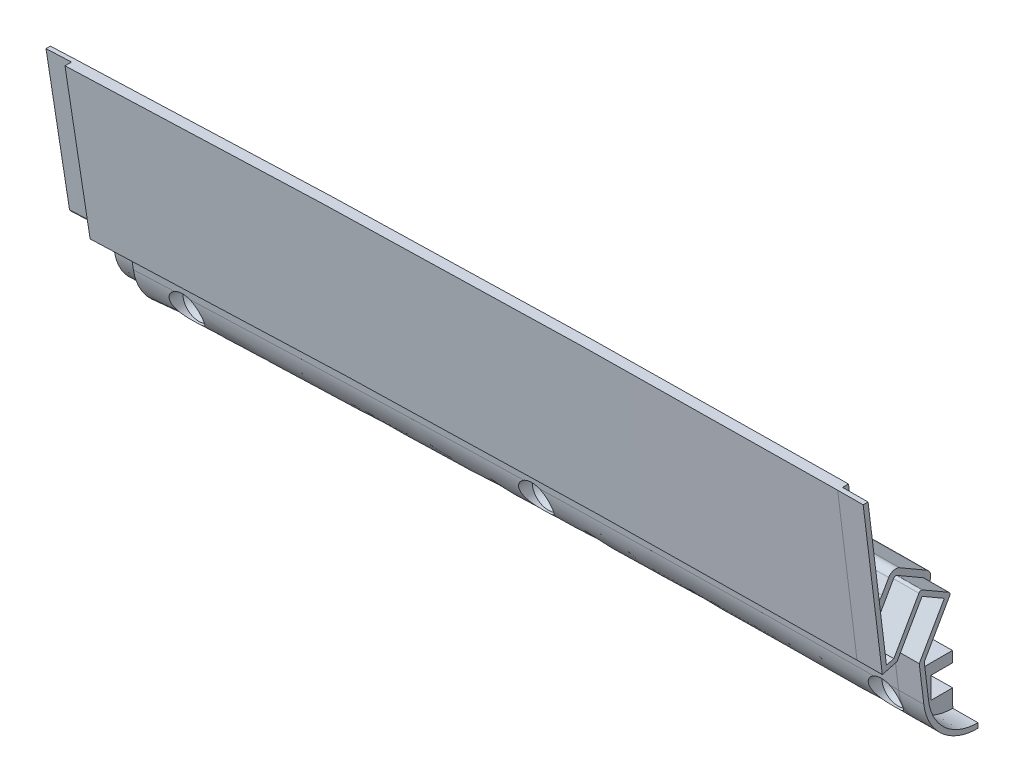
from build123d import *


with BuildPart() as part:
    # Sweep3: sweep along a path in Sketch3
    with BuildLine(Plane.XY.offset(101.6)) as sweep3_path:
        ThreePointArc((622.103936151, -83.199836272), (0, -43.636564626), (-622.103936151, -83.199836272))
    # Sketch4 → Sweep3 (sweep)
    with BuildSketch(Plane(origin=(-117.330566703, 4.430423936, 1117.6), x_dir=(0, 0, -1), z_dir=(0.9994536405585157, 0.03305178322465143, 0))):
        with BuildLine():
            Line((991.529482971, -5.453775083), (988.971801376, -5.453775083))
            Line((988.971801376, -5.453775083), (993.32506615, -42.283775083))
            Line((993.32506615, -42.283775083), (996.794703229, -41.354088728))
            Line((996.794703229, -41.354088728), (1002.763703229, -31.015013775))
            Line((1002.763703229, -31.015013775), (1007.999, -34.037749136))
            Line((1007.999, -34.037749136), (1002.03, -44.376824659))
            Line((1002.03, -44.376824659), (1003.077032208, -53.235049058))
            ThreePointArc((1003.077032208, -53.235049058), (1007.29752688, -61.276835992), (1015.8095, -64.443731312))
            Line((1015.8095, -64.443731312), (1015.8095, -59.12218153))
            Line((1015.8095, -59.12218153), (1010.7295, -59.12218153))
            Line((1010.7295, -59.12218153), (1010.7295, -54.041969025))
            Line((1010.7295, -54.041969025), (1015.8095, -54.041969025))
            Line((1015.8095, -54.041969025), (1015.8095, -51.501969025))
            Line((1015.8095, -51.501969025), (1007.687322123, -51.501969025))
            ThreePointArc((1007.687322123, -51.501969025), (1005.99997215, -50.860507955), (1005.164881483, -49.260118685))
            Line((1005.164881483, -49.260118685), (1004.750455768, -45.75394576))
            ThreePointArc((1004.750455768, -45.75394576), (1004.7850335, -44.943801809), (1005.073167189, -44.18583887))
            Line((1005.073167189, -44.18583887), (1010.516206197, -34.757795418))
            ThreePointArc((1010.516206197, -34.757795418), (1010.706497969, -33.312277166), (1009.818941274, -32.155567572))
            Line((1009.818941274, -32.155567572), (1003.483804566, -28.49781089))
            ThreePointArc((1003.483804566, -28.49781089), (1002.038222268, -28.307482122), (1000.881475684, -29.195102853))
            Line((1000.881475684, -29.195102853), (999.272416391, -31.982200293))
            ThreePointArc((999.272416391, -31.982200293), (996.560692883, -33.200105913), (994.550246564, -31.010392672))
            Line((994.550246564, -31.010392672), (991.529482971, -5.453775083))
        make_face()
    sweep(path=sweep3_path.line)

    # SurfaceCut1
    split(bisect_by=Plane(origin=(-211.442164364, -9.040193423, 0), x_dir=(0.04271589869142412, -0.9990872594518379, 0), z_dir=(-0.9990872594518379, -0.04271589869142412, 0)), keep=Keep.BOTTOM)

    # SurfaceCut2
    split(bisect_by=Plane(origin=(-29.192599192, -0.172013281, 0), x_dir=(-0.005892256941615429, 0.9999826405033909, 0), z_dir=(0.999982640503391, 0.005892256941615429, 0)), keep=Keep.BOTTOM)

    # Sketch8 → Cut-Revolve1 (revolve, cut)
    with BuildSketch(Plane(origin=(-117.056038996, -3.871025798, 0), x_dir=(0, 0, -1), z_dir=(0.9994536405585157, 0.03305178322465143, 0)), mode=Mode.PRIVATE) as cut_revolve1_sk:
        Polygon((-119.5705, -48.27608749), (-106.8705, -48.27608749), (-106.8705, -46.37108749), (-108.7755, -46.37108749), (-110.6805, -44.46608749), (-119.5705, -44.46608749), align=None)
    cut_revolve1 = revolve(cut_revolve1_sk.sketch.rotate(Axis((-115.460428217, -52.120737191, 119.5705), (0, 0, -1)), 91.894072645), axis=Axis((-115.460428217, -52.120737191, 119.5705), (0, 0, -1)), mode=Mode.SUBTRACT)

    # Sketch-Pattern1: Cut-Revolve1 at 2 more places
    with Locations((82.543476, 1.248991, 0), (-82.510753, -2.638363, 0)):
        add(cut_revolve1, mode=Mode.SUBTRACT)

    # Sweep4: sweep along a path in Sketch12
    with BuildLine(Plane(origin=(0, 0, 101.7905), x_dir=(-1, 0, 0), z_dir=(0, 0, -1))) as sweep4_path:
        ThreePointArc((28.923939495, -45.766602298), (25.939444289, -45.749923893), (22.954939495, -45.735060057))
    # Sketch11 → Sweep4 (sweep)
    with BuildSketch(Plane(origin=(-29.192599192, -0.172013281, 0), x_dir=(0, 0, -1), z_dir=(0.999982640503391, 0.005892256941615428, 0))):
        with BuildLine():
            Line((-127.477241199, 0.450754671), (-123.294888708, -34.931694229))
            Line((-123.294888708, -34.931694229), (-121.558436986, -34.466434356))
            Line((-121.558436986, -34.466434356), (-115.572163807, -24.097905064))
            ThreePointArc((-115.572163807, -24.097905064), (-115.18658777, -23.802042164), (-114.704737676, -23.865478932))
            Line((-114.704737676, -23.865478932), (-108.589559095, -27.396078932))
            ThreePointArc((-108.589559095, -27.396078932), (-108.293696195, -27.78165497), (-108.357132963, -28.263505064))
            Line((-108.357132963, -28.263505064), (-114.390345193, -38.713335178))
            Line((-114.390345193, -38.713335178), (-113.38787021, -47.194209001))
            add(Edge.make_bspline(
                [(-113.38787021, -47.194209001), (-113.304795542, -47.897015286), (-113.005394664, -49.296950508), (-111.931567303, -51.887766674), (-109.715936846, -54.711189622), (-106.035083238, -56.912041533), (-103.201893406, -57.40687139), (-101.801323322, -57.393608485)],
                knots=[0, 0, 0, 0, 0.125, 0.25, 0.5, 0.75, 1, 1, 1, 1], degree=3))
            Line((-101.801323322, -57.393608485), (-101.7905, -57.393608485))
            Line((-101.7905, -57.393608485), (-101.7905, -58.536557239))
            add(Edge.make_bspline(
                [(-114.522967792, -47.328382324), (-114.477136038, -47.716115973), (-114.413580033, -48.100730317), (-114.251122313, -48.863738485), (-114.152305696, -49.241112059), (-113.807619255, -50.348945998), (-113.512952594, -51.060115168), (-112.794349261, -52.427883143), (-112.366195112, -53.087853964), (-111.411403795, -54.300376515), (-110.882225451, -54.859655538), (-110.009875034, -55.627276078), (-109.70425095, -55.872304735), (-109.076570448, -56.329701679), (-108.75418736, -56.542634853), (-107.762018779, -57.135262706), (-107.067422067, -57.469169757), (-105.974437358, -57.875747427), (-105.601773783, -57.995121481), (-104.85459633, -58.197305657), (-104.478193263, -58.280870856), (-103.340677537, -58.479835857), (-102.571330027, -58.543951425), (-101.7905, -58.536557239)],
                knots=[0, 0, 0, 0, 0.0625, 0.0625, 0.125, 0.125, 0.25, 0.25, 0.375, 0.375, 0.5, 0.5, 0.5625, 0.5625, 0.625, 0.625, 0.75, 0.75, 0.8125, 0.8125, 0.875, 0.875, 1, 1, 1, 1], degree=3))
            Line((-114.522967792, -47.328382324), (-115.57, -38.470557239))
            Line((-115.57, -38.470557239), (-109.601, -28.131945969))
            Line((-109.601, -28.131945969), (-114.836296771, -25.109345969))
            Line((-114.836296771, -25.109345969), (-120.805296771, -35.447957239))
            Line((-120.805296771, -35.447957239), (-124.27493385, -36.377601804))
            Line((-124.27493385, -36.377601804), (-128.628198624, 0.450754671))
            Line((-128.628198624, 0.450754671), (-127.477241199, 0.450754671))
        make_face()
    sweep(path=sweep4_path.line)

    # Sweep5: sweep along a path in Sketch16
    with BuildLine(Plane(origin=(0, 0, 101.7905), x_dir=(-1, 0, 0), z_dir=(0, 0, -1))) as sweep5_path:
        ThreePointArc((215.647406705, -50.42045008), (212.665748146, -50.290245196), (209.684010975, -50.161853153))
    # Sketch15 → Sweep5 (sweep)
    with BuildSketch(Plane(origin=(-211.442164364, -9.040193423, 0), x_dir=(0, 0, 1), z_dir=(-0.9990872594518379, -0.04271589869142412, 0))):
        with BuildLine():
            Line((113.00950435, -42.713331456), (113.97237291, -34.567525415))
            ThreePointArc((113.97237291, -34.567525415), (113.963727961, -34.364981701), (113.891689273, -34.175484686))
            Line((113.891689273, -34.175484686), (107.519177285, -23.137970149))
            Line((107.519177285, -23.137970149), (115.394119486, -18.591370149))
            Line((115.394119486, -18.591370149), (121.677968823, -29.475316467))
            ThreePointArc((121.677968823, -29.475316467), (121.841334284, -29.661598015), (122.06355177, -29.771181218))
            Line((122.06355177, -29.771181218), (122.259394286, -29.823654698))
            ThreePointArc((122.259394286, -29.823654698), (122.780015415, -29.735923875), (123.054347243, -29.284830643))
            Line((123.054347243, -29.284830643), (127.093588723, 4.886907775))
            Line((127.093588723, 4.886907775), (126.070517029, 4.886907775))
            Line((126.070517029, 4.886907775), (123.049753436, -20.668571968))
            add(Edge.make_bspline(
                [(123.049753436, -20.668571968), (123.018406598, -20.933764287), (122.944898871, -21.192703381), (122.72486191, -21.671025374), (122.574983618, -21.89613649), (122.218479429, -22.283693321), (122.006878086, -22.451668909), (121.662818096, -22.646204147), (121.543504304, -22.701961436), (121.295473201, -22.795007288), (121.166493424, -22.832124521), (120.907997451, -22.885096572), (120.777385583, -22.901432856), (120.51342226, -22.913717924), (120.37910716, -22.909438417), (120.116311005, -22.880334184), (119.986998098, -22.855691982), (119.732512188, -22.786374688), (119.606266969, -22.741161694), (119.243601748, -22.578043456), (119.021351761, -22.432970621), (118.626712377, -22.076251458), (118.461102845, -21.871598209), (118.327583609, -21.640336089)],
                knots=[0, 0, 0, 0, 0.125, 0.125, 0.25, 0.25, 0.375, 0.375, 0.4375, 0.4375, 0.5, 0.5, 0.5625, 0.5625, 0.625, 0.625, 0.6875, 0.6875, 0.75, 0.75, 0.875, 0.875, 1, 1, 1, 1], degree=3))
            Line((118.327583609, -21.640336089), (116.718524316, -18.853363359))
            ThreePointArc((116.718524316, -18.853363359), (115.561765682, -17.965779092), (114.116195434, -18.156102576))
            Line((114.116195434, -18.156102576), (107.781058726, -21.813695606))
            ThreePointArc((107.781058726, -21.813695606), (106.893505265, -22.97034131), (107.083793803, -24.415806877))
            Line((107.083793803, -24.415806877), (112.526832811, -33.84342694))
            ThreePointArc((112.526832811, -33.84342694), (112.814966033, -34.601353512), (112.849544232, -35.411463252))
            Line((112.849544232, -35.411463252), (112.435118517, -38.917478209))
            ThreePointArc((112.435118517, -38.917478209), (111.600006373, -40.51781438), (109.912677877, -41.159227425))
            Line((109.912677877, -41.159227425), (101.7905, -41.159227425))
            Line((101.7905, -41.159227425), (101.7905, -43.699112741))
            Line((101.7905, -43.699112741), (106.8705, -43.699112741))
            Line((106.8705, -43.699112741), (106.8705, -48.779095512))
            Line((106.8705, -48.779095512), (101.7905, -48.779095512))
            Line((101.7905, -48.779095512), (101.7905, -52.576472462))
            Line((101.7905, -52.576472462), (101.804931097, -52.576472462))
            add(Edge.make_bspline(
                [(101.804931097, -52.576472462), (102.489279498, -52.582953001), (103.868868527, -52.467414443), (106.485766193, -51.75509811), (109.465837716, -49.976138537), (112.028433947, -46.715360308), (112.850511097, -44.058404026), (113.00950435, -42.713331456)],
                knots=[0, 0, 0, 0, 0.125, 0.25, 0.5, 0.75, 1, 1, 1, 1], degree=3))
        make_face()
    sweep(path=sweep5_path.line)


solid = part.part
